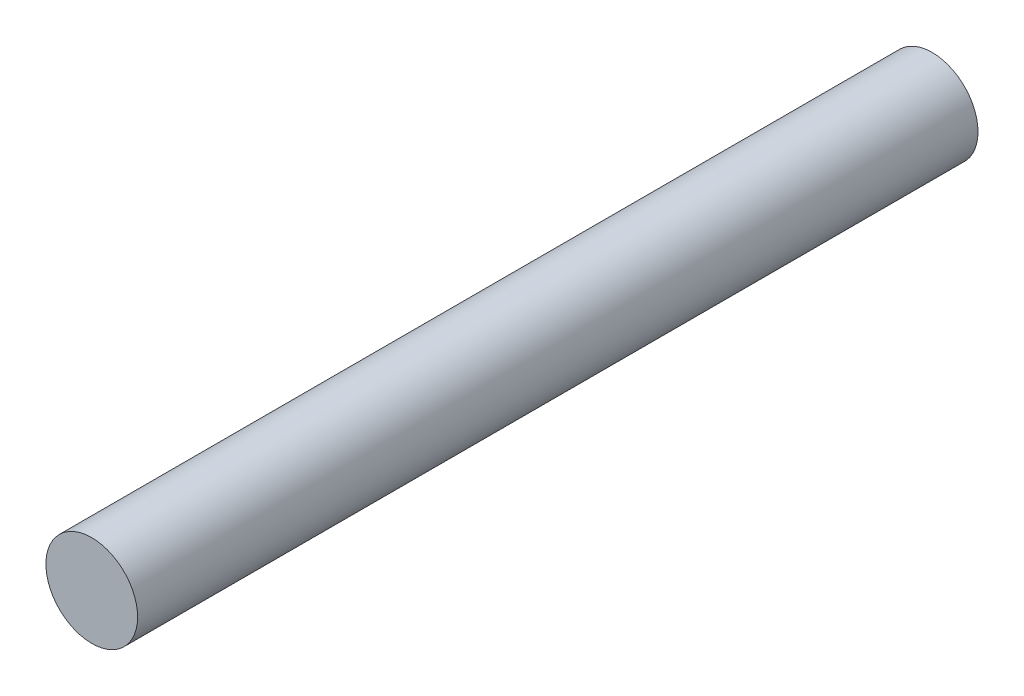
from build123d import *

# Parameters (mm, degrees)
SKETCH1_R           = 2.4
BOSS_EXTRUDE1_DEPTH = 44


with BuildPart() as part:
    # Sketch1 → Boss-Extrude1 (new body)
    with BuildSketch(Plane.XY):
        Circle(SKETCH1_R)
    extrude(amount=BOSS_EXTRUDE1_DEPTH)


solid = part.part
